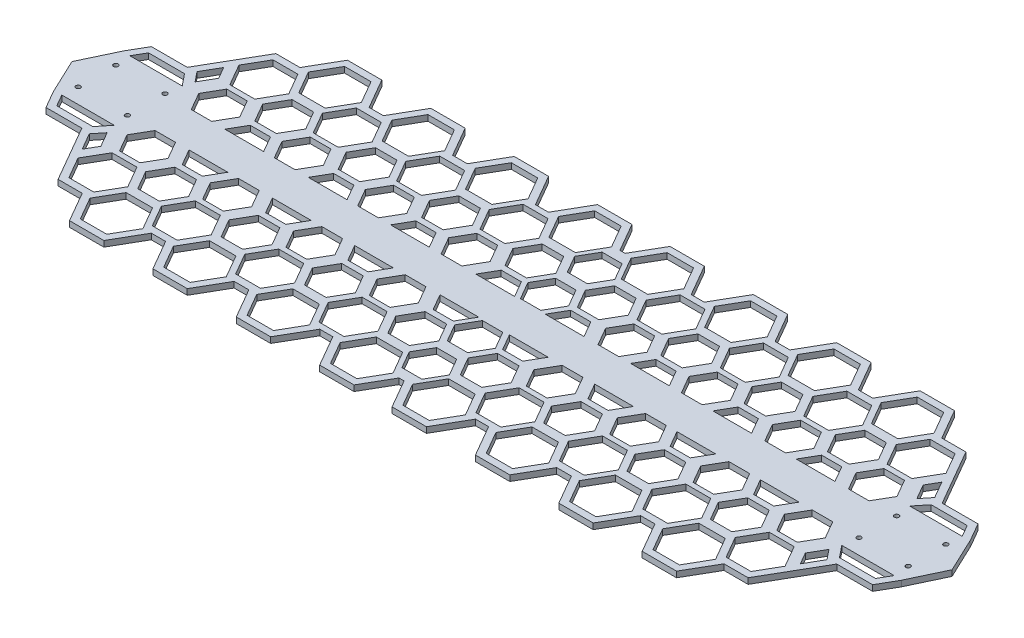
from build123d import *

# Parameters (mm, degrees)
SKETCH2_W                    = 965.2
SKETCH2_H                    = 304.8
BOSS_EXTRUDE1_DEPTH          = 6.35
CUT_EXTRUDE3_DEPTH           = 507.13125027
CUT_EXTRUDE4_DEPTH           = 507.13125027
CUT_EXTRUDE5_DEPTH           = 507.13125027
MIRROR11_COPY_1_DEPTH        = 507.13125027
MIRROR11_COPY_2_DEPTH        = 507.13125027
F_10_0_1935_DIAMETER_HOLE2_D = 4.9149


with BuildPart() as part:
    # Sketch2 → Boss-Extrude1 (new body)
    with BuildSketch(Plane(origin=(0, 0, 0), x_dir=(1, 0, 0), z_dir=(0, 1, 0))):
        Rectangle(SKETCH2_W, SKETCH2_H)
    extrude(amount=BOSS_EXTRUDE1_DEPTH)

    # Sketch7 → Cut-Extrude3 (cut, through all)
    with BuildSketch(Plane(origin=(0, 6.35, 0), x_dir=(1, 0, 0), z_dir=(0, 1, 0))):
        Polygon((-16.10013485, 64.205726722), (-27.897788881, 84.639862914), (-51.493096943, 84.639862914), (-63.290750974, 64.205726722), (-51.493096943, 43.77159053), (-27.897788881, 43.77159053), align=None)
        Polygon((-10.698063798, 119.777667092), (-25.196753355, 144.890134049), (-54.19413247, 144.890134049), (-68.692822027, 119.777667092), (-54.19413247, 94.665200136), (-25.196753355, 94.665200136), align=None)
        Polygon((-63.342547112, 39.328268759), (-74.697856849, 58.99624216), (-97.408476324, 58.99624216), (-108.763786061, 39.328268759), (-97.408476324, 19.660295358), (-74.697856849, 19.660295358), align=None)
        Polygon((-58.745423058, 88.260379231), (-72.399294822, 111.909578847), (-99.707038351, 111.909578847), (-113.360910116, 88.260379231), (-99.707038351, 64.611179615), (-72.399294822, 64.611179615), align=None)
        Polygon((-107.54013485, 64.205726722), (-119.337788881, 84.639862914), (-142.933096943, 84.639862914), (-154.730750974, 64.205726722), (-142.933096943, 43.77159053), (-119.337788881, 43.77159053), align=None)
        Polygon((-102.138063798, 119.777667092), (-116.636753355, 144.890134049), (-145.63413247, 144.890134049), (-160.132822027, 119.777667092), (-145.63413247, 94.665200136), (-116.636753355, 94.665200136), align=None)
        Polygon((-154.782547112, 39.328268759), (-166.137856849, 58.99624216), (-188.848476324, 58.99624216), (-200.203786061, 39.328268759), (-188.848476324, 19.660295358), (-166.137856849, 19.660295358), align=None)
        Polygon((-150.185423058, 88.260379231), (-163.839294822, 111.909578847), (-191.147038351, 111.909578847), (-204.800910116, 88.260379231), (-191.147038351, 64.611179615), (-163.839294822, 64.611179615), align=None)
        Polygon((-198.98013485, 64.205726722), (-210.777788881, 84.639862914), (-234.373096943, 84.639862914), (-246.170750974, 64.205726722), (-234.373096943, 43.77159053), (-210.777788881, 43.77159053), align=None)
        Polygon((-193.578063797, 119.777667092), (-208.076753355, 144.890134049), (-237.074132469, 144.890134049), (-251.572822027, 119.777667092), (-237.074132469, 94.665200136), (-208.076753355, 94.665200136), align=None)
        Polygon((-246.222547112, 39.328268759), (-257.577856849, 58.99624216), (-280.288476324, 58.99624216), (-291.643786061, 39.328268759), (-280.288476324, 19.660295358), (-257.577856849, 19.660295358), align=None)
        Polygon((-241.625423058, 88.260379231), (-255.279294822, 111.909578847), (-282.587038351, 111.909578847), (-296.240910115, 88.260379231), (-282.587038351, 64.611179615), (-255.279294822, 64.611179615), align=None)
        Polygon((-290.42013485, 64.205726722), (-302.217788881, 84.639862914), (-325.813096943, 84.639862914), (-337.610750974, 64.205726722), (-325.813096943, 43.77159053), (-302.217788881, 43.77159053), align=None)
        Polygon((-285.018063797, 119.777667092), (-299.516753355, 144.890134049), (-328.514132469, 144.890134049), (-343.012822027, 119.777667092), (-328.514132469, 94.665200136), (-299.516753355, 94.665200136), align=None)
        Polygon((-333.065423058, 88.260379231), (-346.719294822, 111.909578847), (-374.027038351, 111.909578847), (-387.680910115, 88.260379231), (-374.027038351, 64.611179615), (-346.719294822, 64.611179615), align=None)
        Polygon((-393.785373031, 77.588543343), (-404.49427698, 59.04017761), (-395.751571674, 48.220094686), (-386.290531483, 64.607096989), align=None)
        Polygon((-337.92047672, 39.328268759), (-349.146821653, 58.772868567), (-371.59951152, 58.772868567), (-382.825856454, 39.328268759), (-371.59951152, 19.883668951), (-349.146821653, 19.883668951), align=None)
        Polygon((-409.408343114, 50.276431677), (-448.909115981, 50.276431677), (-456.398618183, 37.30423334), (-398.92671298, 37.30423334), align=None)
        Polygon((-232.860454701, 37.30423334), (-210.747118836, 37.30423334), (-200.560386492, 19.660295358), (-243.047187044, 19.660295358), align=None)
        Polygon((-324.331124746, 37.30423334), (-302.217788881, 37.30423334), (-292.031056538, 19.660295358), (-334.517857089, 19.660295358), align=None)
        Polygon((-142.667867382, 37.30423334), (-120.554531517, 37.30423334), (-110.367799174, 19.660295358), (-152.854599725, 19.660295358), align=None)
        Polygon((-49.13192899, 37.30423334), (-27.018593125, 37.30423334), (-16.831860781, 19.660295358), (-59.318661333, 19.660295358), align=None)
    cut_extrude3 = extrude(amount=-CUT_EXTRUDE3_DEPTH, mode=Mode.SUBTRACT)

    # Sketch8 → Cut-Extrude4 (cut, through all)
    with BuildSketch(Plane(origin=(0, 6.35, 0), x_dir=(1, 0, 0), z_dir=(0, 1, 0))):
        Polygon((10.994488416, 109.737813004), (-10.994488416, 109.737813004), (-21.988976832, 90.694800464), (-10.994488416, 71.651787924), (10.994488416, 71.651787924), (21.988976832, 90.694800464), align=None)
        Polygon((10.728851511, 59.450017641), (-11.556453484, 59.450017641), (-22.699105982, 40.150377383), (-11.556453484, 20.850737126), (10.728851511, 20.850737126), (21.871504009, 40.150377383), align=None)
    cut_extrude4 = extrude(amount=-CUT_EXTRUDE4_DEPTH, mode=Mode.SUBTRACT)

    # Sketch3 → Cut-Extrude5 (cut, through all)
    with BuildSketch(Plane(origin=(0, 6.35, 0), x_dir=(1, 0, 0), z_dir=(0, 1, 0))):
        Polygon((-482.6, 0), (-464.776023202, 37.631442932), (-464.881349894, 37.631442932), (-453.24493911, 57.786297628), (-413.946775589, 57.786297628), (-395.646450209, 89.483390982), (-378.36286148, 119.419444799), (-351.891288022, 119.419444799), (-332.849955598, 152.4), (-295.180930226, 152.4), (-276.139597803, 119.419444799), (-260.451288022, 119.419444799), (-241.409955598, 152.4), (-203.740930226, 152.4), (-184.90641754, 119.777667092), (-168.804468284, 119.777667092), (-149.969955598, 152.4), (-112.300930226, 152.4), (-92.579101272, 118.240790232), (-78.251784553, 118.240790232), (-58.529955598, 152.4), (-20.860930226, 152.4), (-2.823570321, 121.158376209), (0, 121.158376209), (0, 240.353310545), (-11.734407676, 240.353310545), (-689.383609758, 240.353310545), (-689.383609758, 0), align=None)
    cut_extrude5 = extrude(amount=-CUT_EXTRUDE5_DEPTH, mode=Mode.SUBTRACT)

    # Mirror10: Cut-Extrude3, Cut-Extrude5 across plane
    add(cut_extrude3.mirror(Plane(origin=(0, 0, 0), x_dir=(0, 0, 1), z_dir=(1, 0, 0))), mode=Mode.SUBTRACT)
    add(cut_extrude5.mirror(Plane(origin=(0, 0, 0), x_dir=(0, 0, 1), z_dir=(1, 0, 0))), mode=Mode.SUBTRACT)

    # Mirror11: Cut-Extrude3, Cut-Extrude4, Cut-Extrude5 across plane
    add(cut_extrude3.mirror(Plane.XY), mode=Mode.SUBTRACT)
    add(cut_extrude4.mirror(Plane.XY), mode=Mode.SUBTRACT)
    add(cut_extrude5.mirror(Plane.XY), mode=Mode.SUBTRACT)

    # Mirror11 copy 1 sketch → Mirror11 copy 1 (cut, through all)
    with BuildSketch(Plane(origin=(0, 6.35, 0), x_dir=(-1, 0, 0), z_dir=(0, 1, 0))):
        Polygon((-16.10013485, 64.205726722), (-27.897788881, 84.639862914), (-51.493096943, 84.639862914), (-63.290750974, 64.205726722), (-51.493096943, 43.77159053), (-27.897788881, 43.77159053), align=None)
        Polygon((-10.698063798, 119.777667092), (-25.196753355, 144.890134049), (-54.19413247, 144.890134049), (-68.692822027, 119.777667092), (-54.19413247, 94.665200136), (-25.196753355, 94.665200136), align=None)
        Polygon((-63.342547112, 39.328268759), (-74.697856849, 58.99624216), (-97.408476324, 58.99624216), (-108.763786061, 39.328268759), (-97.408476324, 19.660295358), (-74.697856849, 19.660295358), align=None)
        Polygon((-58.745423058, 88.260379231), (-72.399294822, 111.909578847), (-99.707038351, 111.909578847), (-113.360910116, 88.260379231), (-99.707038351, 64.611179615), (-72.399294822, 64.611179615), align=None)
        Polygon((-107.54013485, 64.205726722), (-119.337788881, 84.639862914), (-142.933096943, 84.639862914), (-154.730750974, 64.205726722), (-142.933096943, 43.77159053), (-119.337788881, 43.77159053), align=None)
        Polygon((-102.138063798, 119.777667092), (-116.636753355, 144.890134049), (-145.63413247, 144.890134049), (-160.132822027, 119.777667092), (-145.63413247, 94.665200136), (-116.636753355, 94.665200136), align=None)
        Polygon((-154.782547112, 39.328268759), (-166.137856849, 58.99624216), (-188.848476324, 58.99624216), (-200.203786061, 39.328268759), (-188.848476324, 19.660295358), (-166.137856849, 19.660295358), align=None)
        Polygon((-150.185423058, 88.260379231), (-163.839294822, 111.909578847), (-191.147038351, 111.909578847), (-204.800910116, 88.260379231), (-191.147038351, 64.611179615), (-163.839294822, 64.611179615), align=None)
        Polygon((-198.98013485, 64.205726722), (-210.777788881, 84.639862914), (-234.373096943, 84.639862914), (-246.170750974, 64.205726722), (-234.373096943, 43.77159053), (-210.777788881, 43.77159053), align=None)
        Polygon((-193.578063797, 119.777667092), (-208.076753355, 144.890134049), (-237.074132469, 144.890134049), (-251.572822027, 119.777667092), (-237.074132469, 94.665200136), (-208.076753355, 94.665200136), align=None)
        Polygon((-246.222547112, 39.328268759), (-257.577856849, 58.99624216), (-280.288476324, 58.99624216), (-291.643786061, 39.328268759), (-280.288476324, 19.660295358), (-257.577856849, 19.660295358), align=None)
        Polygon((-241.625423058, 88.260379231), (-255.279294822, 111.909578847), (-282.587038351, 111.909578847), (-296.240910115, 88.260379231), (-282.587038351, 64.611179615), (-255.279294822, 64.611179615), align=None)
        Polygon((-290.42013485, 64.205726722), (-302.217788881, 84.639862914), (-325.813096943, 84.639862914), (-337.610750974, 64.205726722), (-325.813096943, 43.77159053), (-302.217788881, 43.77159053), align=None)
        Polygon((-285.018063797, 119.777667092), (-299.516753355, 144.890134049), (-328.514132469, 144.890134049), (-343.012822027, 119.777667092), (-328.514132469, 94.665200136), (-299.516753355, 94.665200136), align=None)
        Polygon((-333.065423058, 88.260379231), (-346.719294822, 111.909578847), (-374.027038351, 111.909578847), (-387.680910115, 88.260379231), (-374.027038351, 64.611179615), (-346.719294822, 64.611179615), align=None)
        Polygon((-393.785373031, 77.588543343), (-404.49427698, 59.04017761), (-395.751571674, 48.220094686), (-386.290531483, 64.607096989), align=None)
        Polygon((-337.92047672, 39.328268759), (-349.146821653, 58.772868567), (-371.59951152, 58.772868567), (-382.825856454, 39.328268759), (-371.59951152, 19.883668951), (-349.146821653, 19.883668951), align=None)
        Polygon((-409.408343114, 50.276431677), (-448.909115981, 50.276431677), (-456.398618183, 37.30423334), (-398.92671298, 37.30423334), align=None)
        Polygon((-232.860454701, 37.30423334), (-210.747118836, 37.30423334), (-200.560386492, 19.660295358), (-243.047187044, 19.660295358), align=None)
        Polygon((-324.331124746, 37.30423334), (-302.217788881, 37.30423334), (-292.031056538, 19.660295358), (-334.517857089, 19.660295358), align=None)
        Polygon((-142.667867382, 37.30423334), (-120.554531517, 37.30423334), (-110.367799174, 19.660295358), (-152.854599725, 19.660295358), align=None)
        Polygon((-49.13192899, 37.30423334), (-27.018593125, 37.30423334), (-16.831860781, 19.660295358), (-59.318661333, 19.660295358), align=None)
    extrude(amount=-MIRROR11_COPY_1_DEPTH, mode=Mode.SUBTRACT)

    # Mirror11 copy 2 sketch → Mirror11 copy 2 (cut, through all)
    with BuildSketch(Plane(origin=(0, 6.35, 0), x_dir=(-1, 0, 0), z_dir=(0, 1, 0))):
        Polygon((-482.6, 0), (-464.776023202, 37.631442932), (-464.881349894, 37.631442932), (-453.24493911, 57.786297628), (-413.946775589, 57.786297628), (-395.646450209, 89.483390982), (-378.36286148, 119.419444799), (-351.891288022, 119.419444799), (-332.849955598, 152.4), (-295.180930226, 152.4), (-276.139597803, 119.419444799), (-260.451288022, 119.419444799), (-241.409955598, 152.4), (-203.740930226, 152.4), (-184.90641754, 119.777667092), (-168.804468284, 119.777667092), (-149.969955598, 152.4), (-112.300930226, 152.4), (-92.579101272, 118.240790232), (-78.251784553, 118.240790232), (-58.529955598, 152.4), (-20.860930226, 152.4), (-2.823570321, 121.158376209), (0, 121.158376209), (0, 240.353310545), (-11.734407676, 240.353310545), (-689.383609758, 240.353310545), (-689.383609758, 0), align=None)
    extrude(amount=-MIRROR11_COPY_2_DEPTH, mode=Mode.SUBTRACT)

    # #10 (0.1935) Diameter Hole2 (through all)
    with Locations(Plane(origin=(0, 6.35, 0), x_dir=(1, 0, 0), z_dir=(0, 1, 0))):
        with Locations((-401.152408866, -20.6375), (-455.127408866, 20.6375), (-455.127408866, -20.6375), (-401.152408866, 20.6375)):
            f_10_0_1935_diameter_hole2 = Hole(F_10_0_1935_DIAMETER_HOLE2_D / 2)

    # Mirror12: #10 (0.1935) Diameter Hole2 across plane
    add(f_10_0_1935_diameter_hole2.mirror(Plane(origin=(0, 0, 0), x_dir=(0, 0, 1), z_dir=(1, 0, 0))), mode=Mode.SUBTRACT)


solid = part.part
